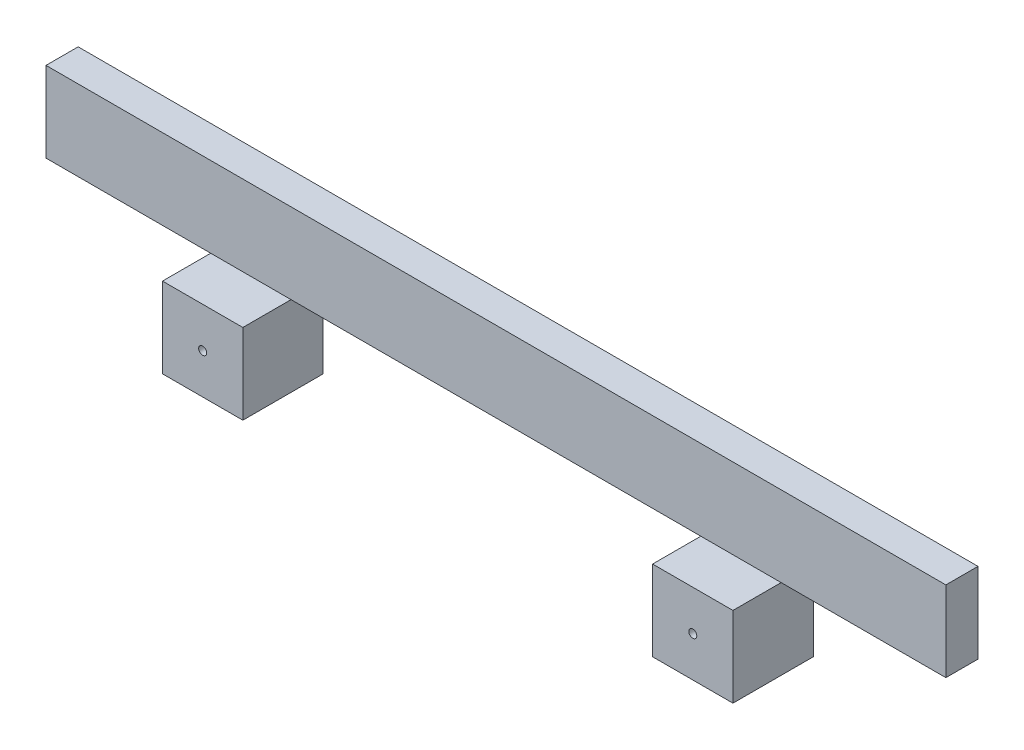
from build123d import *

# Parameters (mm, degrees)
ESQUISSE1_W        = 25
ESQUISSE1_H        = 25
ESQUISSE1_R        = 1.25
BOSS_EXTRU_2_DEPTH = 25
ESQUISSE1_5_W      = 25
ESQUISSE1_5_H      = 25
ESQUISSE1_5_R      = 1.25
BOSS_EXTRU_3_DEPTH = 25
BOSS_EXTRU_4_DEPTH = 10


with BuildPart() as part:
    # Esquisse1 → Boss.-Extru.2 (new body)
    with BuildSketch(Plane.XY):
        with Locations((63.75, -12.5)):
            Rectangle(ESQUISSE1_W, ESQUISSE1_H)
        with Locations((63.75, -12.5)):
            Circle(ESQUISSE1_R, mode=Mode.SUBTRACT)
    extrude(amount=BOSS_EXTRU_2_DEPTH)



with BuildPart() as body_2:
    # Esquisse1<5> → Boss.-Extru.3 (new body)
    with BuildSketch(Plane.XY):
        with Locations((216.25, -12.5)):
            Rectangle(ESQUISSE1_5_W, ESQUISSE1_5_H)
        with Locations((216.25, -12.5)):
            Circle(ESQUISSE1_5_R, mode=Mode.SUBTRACT)
    extrude(amount=BOSS_EXTRU_3_DEPTH)


with BuildPart() as part_1:
    add(part.part)

    add(body_2.part)  # Boss.-Extru.4 merges body 2
    # Esquisse1<7> → Boss.-Extru.4 (add)
    with BuildSketch(Plane.XY):
        Polygon((0, 25), (0, 0), (51.25, 0), (76.25, 0), (203.75, 0), (228.75, 0), (280, 0), (280, 25), align=None)
    extrude(amount=BOSS_EXTRU_4_DEPTH)


solid = part_1.part
